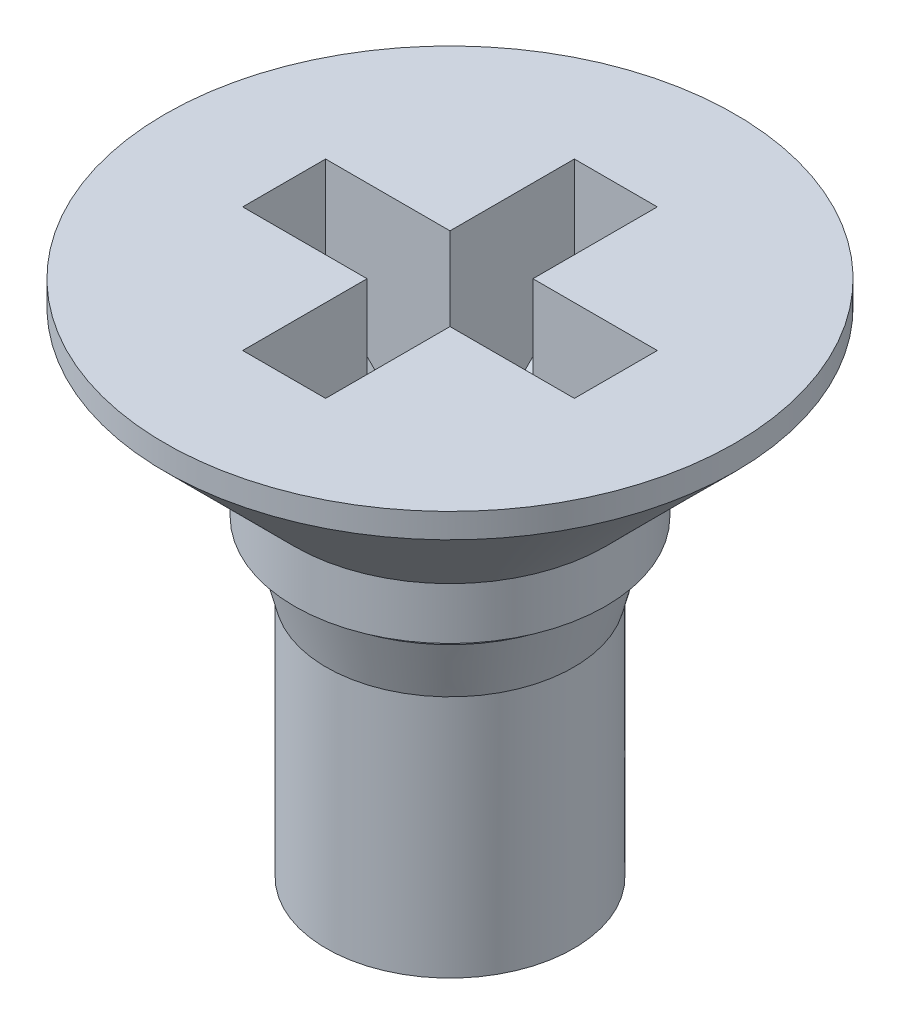
from build123d import *

# Parameters (mm, degrees)
KREUZSCHLITZ1_H_DEPTH      = 0.4
KREUZSCHLITZ1_H_DEPTH_BACK = 0.4
KREUZSCHLITZ2_H_DEPTH      = 0.4
KREUZSCHLITZ2_H_DEPTH_BACK = 0.4
BOSS_EXTRUDE1_START        = 2
SKETCH1_R                  = 1.1935
BOSS_EXTRUDE1_DEPTH        = 2
CUT_EXTRUDE1_DEPTH         = 2
CUT_EXTRUDE1_DEPTH_BACK    = 2
SKETCH2_W                  = 2.387
SKETCH2_H                  = 5


with BuildPart() as part:
    # Skizze1 → Basis-Rotation (revolve)
    with BuildSketch(Plane.XY, mode=Mode.PRIVATE) as basis_rotation_sk:
        Polygon((0, 0), (2.75, 0), (2.75, -0.2375), (1.5, -1.4875), (1.5, -1.9875), (1.3375, -1.9875), (1.3375, -2.112584684), (1.1935, -2.65), (1.1935, -8), (0, -8), align=None)
    revolve(basis_rotation_sk.sketch.rotate(Axis((0, 0, 0), (0, -1, 0)), 180), axis=Axis((0, 0, 0), (0, -1, 0)))

    # Skizze2 → Kreuzschlitz1 H (cut, two sides: drawn at the far end of the back side and taken through both)
    with BuildSketch(Plane.XY.offset(-KREUZSCHLITZ1_H_DEPTH_BACK)):
        Polygon((-0.55, -2.1), (0.55, -2.1), (1.6, -1.05), (1.6, 0), (-1.6, 0), (-1.6, -1.05), align=None)
    extrude(amount=KREUZSCHLITZ1_H_DEPTH + KREUZSCHLITZ1_H_DEPTH_BACK, mode=Mode.SUBTRACT)

    # Skizze3 → Kreuzschlitz2 H (cut, two sides: drawn at the far end of the back side and taken through both)
    with BuildSketch(Plane(origin=(0, 0, 0), x_dir=(0, 0, -1), z_dir=(1, 0, 0)).offset(-KREUZSCHLITZ2_H_DEPTH_BACK)):
        Polygon((-0.55, -2.1), (0.55, -2.1), (1.6, -1.05), (1.6, 0), (-1.6, 0), (-1.6, -1.05), align=None)
    extrude(amount=KREUZSCHLITZ2_H_DEPTH + KREUZSCHLITZ2_H_DEPTH_BACK, mode=Mode.SUBTRACT)

    # Sketch1 → Boss-Extrude1 (add)
    with BuildSketch(Plane.XZ.offset(8).offset(BOSS_EXTRUDE1_START)):
        with Locations(Location((0, 0, 0), (0, 0, 180))):
            Circle(SKETCH1_R)
    extrude(amount=-BOSS_EXTRUDE1_DEPTH)

    # Sketch2 → Cut-Extrude1 (cut, two sides: drawn at the far end of the back side and taken through both)
    with BuildSketch(Plane(origin=(0, 0, 0), x_dir=(0, 0, -1), z_dir=(1, 0, 0)).offset(-CUT_EXTRUDE1_DEPTH_BACK)):
        with Locations((0, -7.5)):
            Rectangle(SKETCH2_W, SKETCH2_H)
    extrude(amount=CUT_EXTRUDE1_DEPTH + CUT_EXTRUDE1_DEPTH_BACK, mode=Mode.SUBTRACT)


solid = part.part
